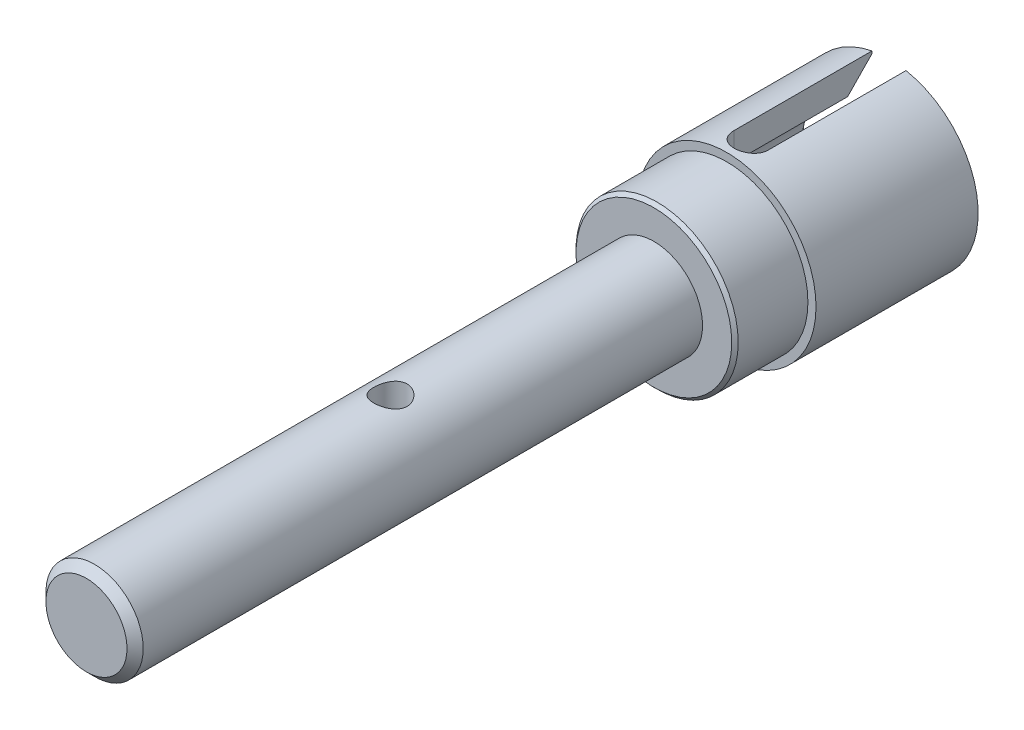
from build123d import *

# Parameters (mm, degrees)
SKETCH_1_R           = 11
EXTRUDE_1_DEPTH      = 29
SKETCH_2_OUTSIDE_W   = 32.506
SKETCH_2_OUTSIDE_H   = 32.506
SKETCH_2_OUTSIDE_R   = 10
CUT_EXTRUDE_1_DEPTH  = 9
SKETCH_3_R           = 7.7
CUT_EXTRUDE_2_DEPTH  = 20
SKETCH_4_R           = 2.1
CUT_EXTRUDE_3_DEPTH  = 25
CHAMFER_1_SIZE       = 3
EXTRUDE_START        = 10
SKETCH_5_R           = 10
EXTRUDE_2_DEPTH      = 10
CUT_EXTRUDE_5_DEPTH  = 19
CUT_EXTRUDE_6_DEPTH  = 19
CHAMFER_2_SIZE       = 0.4
SKETCH_12_R          = 10
CUT_EXTRUDE_9_DEPTH  = 10
SKETCH_13_R          = 4.1
CUT_EXTRUDE_10_DEPTH = 9
CHAMFER_3_SIZE       = 0.4
SKETCH_15_R          = 4.1
EXTRUDE_3_DEPTH      = 9
SKETCH_16_R          = 6
EXTRUDE_4_DEPTH      = 70
CHAMFER_4_SIZE       = 1
SKETCH_17_R          = 2.05
CUT_EXTRUDE_12_DEPTH = 35


with BuildPart() as part:
    # 草图1 → 凸台-拉伸1 (new body)
    with BuildSketch(Plane.XY):
        with Locations(Location((0, 0, 0), (0, 0, 180))):
            Circle(SKETCH_1_R)
    extrude(amount=EXTRUDE_1_DEPTH)

    # 草图2 outside → 切除-拉伸1 (cut)
    with BuildSketch(Plane.XY.offset(29)):
        Rectangle(SKETCH_2_OUTSIDE_W, SKETCH_2_OUTSIDE_H)
        Circle(SKETCH_2_OUTSIDE_R, mode=Mode.SUBTRACT)
    extrude(amount=-CUT_EXTRUDE_1_DEPTH, mode=Mode.SUBTRACT)

    # 草图3 → 切除-拉伸2 (cut)
    with BuildSketch(Plane(origin=(0, 0, 0), x_dir=(-1, 0, 0), z_dir=(0, 0, -1))):
        Circle(SKETCH_3_R)
    extrude(amount=-CUT_EXTRUDE_2_DEPTH, mode=Mode.SUBTRACT)

    # 草图4 → 切除-拉伸3 (cut, symmetric)
    with BuildSketch(Plane(origin=(0, 0, 0), x_dir=(1, 0, 0), z_dir=(0, 1, 0))):
        with BuildLine():
            Line((-2.1, 0), (-2.1, -17))
            ThreePointArc((-2.1, -17), (0, -14.9), (2.1, -17))
            Line((2.1, -17), (2.1, 0))
            Line((2.1, 0), (-2.1, 0))
        make_face()
        with Locations((0, -17)):
            Circle(SKETCH_4_R)
    extrude(amount=CUT_EXTRUDE_3_DEPTH, both=True, mode=Mode.SUBTRACT)

    # 倒角1
    chamfer_1_edges = [part.edges().sort_by_distance(p)[0] for p in [
        (7.7, 0, 0),
        (-6.142475071, -4.643274706, 0),
    ]]
    chamfer(chamfer_1_edges, length=CHAMFER_1_SIZE)

    # 草图5 → 凸台-拉伸2 (add)
    with BuildSketch(Plane.XY.offset(29).offset(EXTRUDE_START)):
        Circle(SKETCH_5_R)
    extrude(amount=-EXTRUDE_2_DEPTH)

    # 草图6 → 切除-拉伸5 (cut)
    with BuildSketch(Plane.XY.offset(39)):
        with BuildLine():
            Line((3.122498999, 2.5), (-3.122498999, 2.5))
            ThreePointArc((-3.122498999, 2.5), (-1.324764885, -3.774254628), (4, 0))
            ThreePointArc((4, 0), (3.774254628, 1.324764885), (3.122498999, 2.5))
        make_face()
    extrude(amount=-CUT_EXTRUDE_5_DEPTH, mode=Mode.SUBTRACT)

    # 草图7 → 切除-拉伸6 (cut)
    with BuildSketch(Plane.XY.offset(39)):
        with BuildLine():
            Line((3.170173497, 2.6), (-3.170173497, 2.6))
            ThreePointArc((-3.170173497, 2.6), (0, -4.1), (3.170173497, 2.6))
        make_face()
    extrude(amount=-CUT_EXTRUDE_6_DEPTH, mode=Mode.SUBTRACT)

    # 倒角2
    chamfer_2_edges = [part.edges().sort_by_distance(p)[0] for p in [
        (0, -4.1, 39),
        (0, 2.6, 39),
    ]]
    chamfer(chamfer_2_edges, length=CHAMFER_2_SIZE)

    # 草图12 → 切除-拉伸9 (cut)
    with BuildSketch(Plane.XY.offset(39)):
        Circle(SKETCH_12_R)
    extrude(amount=-CUT_EXTRUDE_9_DEPTH, mode=Mode.SUBTRACT)

    # 草图13 → 切除-拉伸10 (cut)
    with BuildSketch(Plane.XY.offset(29)):
        Circle(SKETCH_13_R)
    extrude(amount=-CUT_EXTRUDE_10_DEPTH, mode=Mode.SUBTRACT)

    # 倒角3
    chamfer_3_edges = [part.edges().sort_by_distance(p)[0] for p in [
        (-10, 0, 29),
    ]]
    chamfer(chamfer_3_edges, length=CHAMFER_3_SIZE)

    # 草图15 → 凸台-拉伸3 (add)
    with BuildSketch(Plane.XY.offset(29)):
        Circle(SKETCH_15_R)
    extrude(amount=-EXTRUDE_3_DEPTH)

    # 草图16 → 凸台-拉伸4 (add)
    with BuildSketch(Plane.XY.offset(29)):
        Circle(SKETCH_16_R)
    extrude(amount=EXTRUDE_4_DEPTH)

    # 倒角4
    chamfer_4_edges = [part.edges().sort_by_distance(p)[0] for p in [
        (-6, 0, 99),
    ]]
    chamfer(chamfer_4_edges, length=CHAMFER_4_SIZE)

    # 草图17 → 切除-拉伸12 (cut, symmetric)
    with BuildSketch(Plane(origin=(0, 0, 0), x_dir=(1, 0, 0), z_dir=(0, 1, 0))):
        with Locations(Location((0, -61.5, 0), (0, 0, 270))):
            Circle(SKETCH_17_R)
    extrude(amount=CUT_EXTRUDE_12_DEPTH, both=True, mode=Mode.SUBTRACT)


solid = part.part
